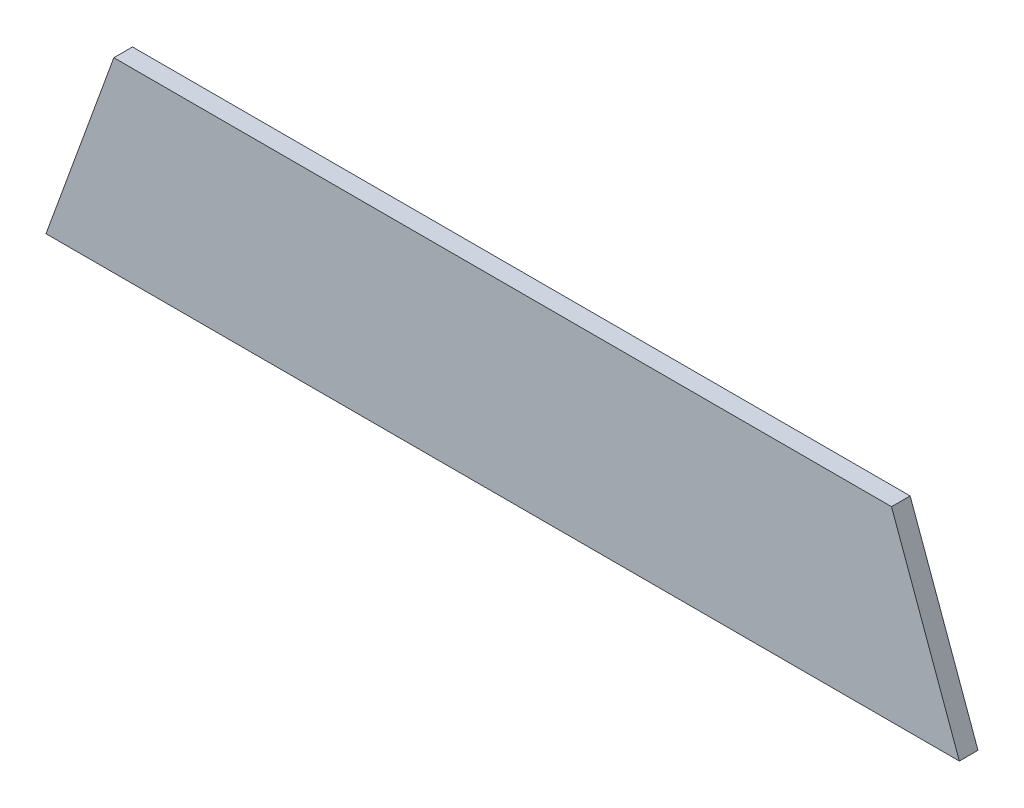
from build123d import *

# Parameters (mm, degrees)
BOSS_EXTRUDE1_DEPTH = 2


with BuildPart() as part:
    # Sketch2 → Boss-Extrude1 (new body)
    with BuildSketch(Plane.XY):
        Polygon((-49.28, -10), (48.72, -10), (41.440595315, 10), (-42.000595315, 10), align=None)
    extrude(amount=BOSS_EXTRUDE1_DEPTH)


solid = part.part
